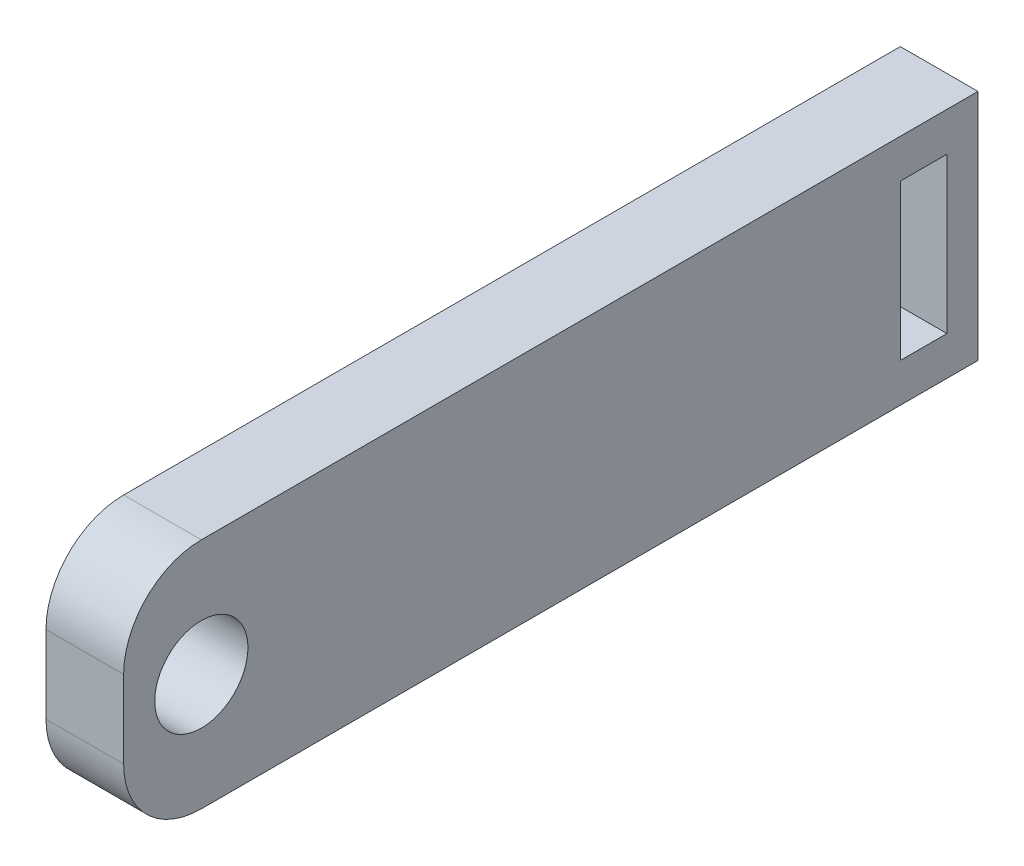
from build123d import *

# Parameters (mm, degrees)
BOSS_EXTRUDE1_DEPTH = 15
SKETCH2_R           = 3
SKETCH2_W           = 3
SKETCH2_H           = 10
CUT_EXTRUDE1_DEPTH  = 5
FILLET1_R           = 5


with BuildPart() as part:
    # Sketch1 → Boss-Extrude1 (new body)
    with BuildSketch(Plane(origin=(0, 0, 0), x_dir=(1, 0, 0), z_dir=(0, 1, 0))):
        Polygon((-61.880536913, 28.790268456), (-61.880536913, -26.209731544), (-56.880536913, -26.209731544), (-56.880536913, 23.790268456), (-56.880536913, 28.790268456), align=None)
    extrude(amount=BOSS_EXTRUDE1_DEPTH)

    # Sketch2 → Cut-Extrude1 (cut)
    with BuildSketch(Plane.ZY.offset(61.880536913)):
        with Locations((21.209731544, 7.5)):
            Circle(SKETCH2_R)
        with Locations((-25.290268456, 7.5)):
            Rectangle(SKETCH2_W, SKETCH2_H)
    extrude(amount=-CUT_EXTRUDE1_DEPTH, mode=Mode.SUBTRACT)

    # Fillet1
    fillet1_edges = [part.edges().sort_by_distance(p)[0] for p in [
        (-59.380536913, 15, 26.209731544),
        (-59.380536913, 0, 26.209731544),
    ]]
    fillet(fillet1_edges, radius=FILLET1_R)


solid = part.part
